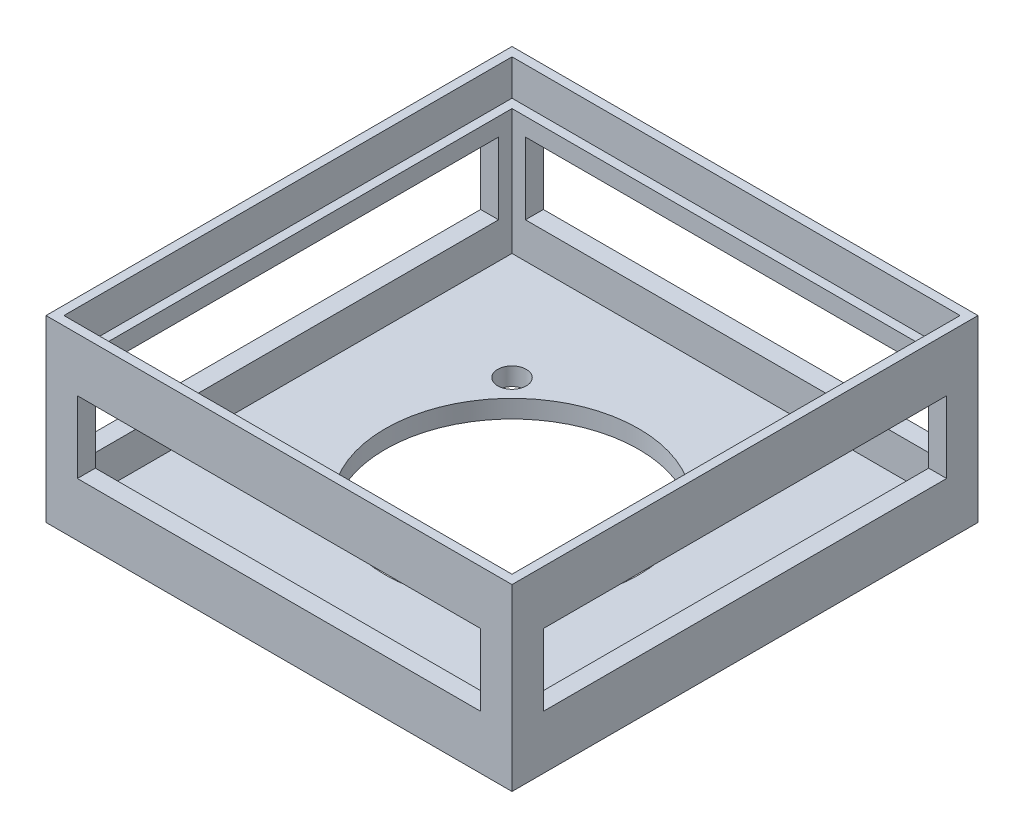
from build123d import *

# Parameters (mm, degrees)
SKETCH_1_W               = 52
SKETCH_1_H               = 52
SKETCH_1_R               = 1.6
SKETCH_1_W_2             = 20
SKETCH_1_H_2             = 20
EXTRUDE_5_DEPTH          = 20
SHELL_6_T                = -2
SKETCH_4_W               = 50
SKETCH_4_H               = 50
SKETCH_4_W_2             = 48
SKETCH_4_H_2             = 48
CUT_EXTRUDE_4_DEPTH      = 4
CUT_EXTRUDE_5_DEPTH      = 60.799665551
CUT_EXTRUDE_5_DEPTH_BACK = 60.799665551
SKETCH_5_W               = 45
SKETCH_5_H               = 8
CUT_EXTRUDE_6_DEPTH      = 60.799665551
CUT_EXTRUDE_6_DEPTH_BACK = 60.799665551
SKETCH_6_W               = 45
SKETCH_6_H               = 8
SKETCH_7_R               = 14.142135624
CUT_EXTRUDE_7_DEPTH      = 10


with BuildPart() as part:
    # 草图1 → 凸台-拉伸5 (new body)
    with BuildSketch(Plane(origin=(0, 0, 0), x_dir=(1, 0, 0), z_dir=(0, 1, 0))):
        Rectangle(SKETCH_1_W, SKETCH_1_H)
        with Locations(Location((-12, 12, 0), (0, 0, 270))):
            Circle(SKETCH_1_R, mode=Mode.SUBTRACT)
        with Locations(Location((12, 12, 0), (0, 0, 270))):
            Circle(SKETCH_1_R, mode=Mode.SUBTRACT)
        with Locations(Location((12, -12, 0), (0, 0, 270))):
            Circle(SKETCH_1_R, mode=Mode.SUBTRACT)
        with Locations(Location((-12, -12, 0), (0, 0, 270))):
            Circle(SKETCH_1_R, mode=Mode.SUBTRACT)
        Rectangle(SKETCH_1_W_2, SKETCH_1_H_2, mode=Mode.SUBTRACT)
    extrude(amount=EXTRUDE_5_DEPTH)

    # 抽壳6
    shell_6_openings = [part.faces().sort_by_distance(p)[0] for p in [
        (-12, 10, 10.4),
        (-10, 10, 0),
        (0, 10, 10),
        (10, 10, 0),
        (0, 10, -10),
        (12, 10, -13.6),
        (-12, 10, -13.6),
        (0, 20, -25.264608948),
        (12, 10, 10.4),
    ]]
    offset(amount=SHELL_6_T, openings=shell_6_openings, kind=Kind.INTERSECTION)

    # 草图4 → 切除-拉伸4 (cut)
    with BuildSketch(Plane(origin=(0, 20, 0), x_dir=(1, 0, 0), z_dir=(0, 1, 0))):
        Rectangle(SKETCH_4_W, SKETCH_4_H)
        Rectangle(SKETCH_4_W_2, SKETCH_4_H_2, mode=Mode.SUBTRACT)
    extrude(amount=-CUT_EXTRUDE_4_DEPTH, mode=Mode.SUBTRACT)

    # 草图5 → 切除-拉伸5 (cut, two sides: drawn at the far end of the back side and taken through both)
    with BuildSketch(Plane.XY.offset(-24).offset(-CUT_EXTRUDE_5_DEPTH_BACK)):
        with Locations((0, 10)):
            Rectangle(SKETCH_5_W, SKETCH_5_H)
    extrude(amount=CUT_EXTRUDE_5_DEPTH + CUT_EXTRUDE_5_DEPTH_BACK, mode=Mode.SUBTRACT)

    # 草图6 → 切除-拉伸6 (cut, two sides: drawn at the far end of the back side and taken through both)
    with BuildSketch(Plane(origin=(-24, 0, 0), x_dir=(0, 0, -1), z_dir=(1, 0, 0)).offset(-CUT_EXTRUDE_6_DEPTH_BACK)):
        with Locations((0, 10)):
            Rectangle(SKETCH_6_W, SKETCH_6_H)
    extrude(amount=CUT_EXTRUDE_6_DEPTH + CUT_EXTRUDE_6_DEPTH_BACK, mode=Mode.SUBTRACT)

    # 草图7 → 切除-拉伸7 (cut)
    with BuildSketch(Plane.XZ):
        with Locations(Location((0, 0, 0), (0, 0, 270))):
            Circle(SKETCH_7_R)
    extrude(amount=-CUT_EXTRUDE_7_DEPTH, mode=Mode.SUBTRACT)


solid = part.part
